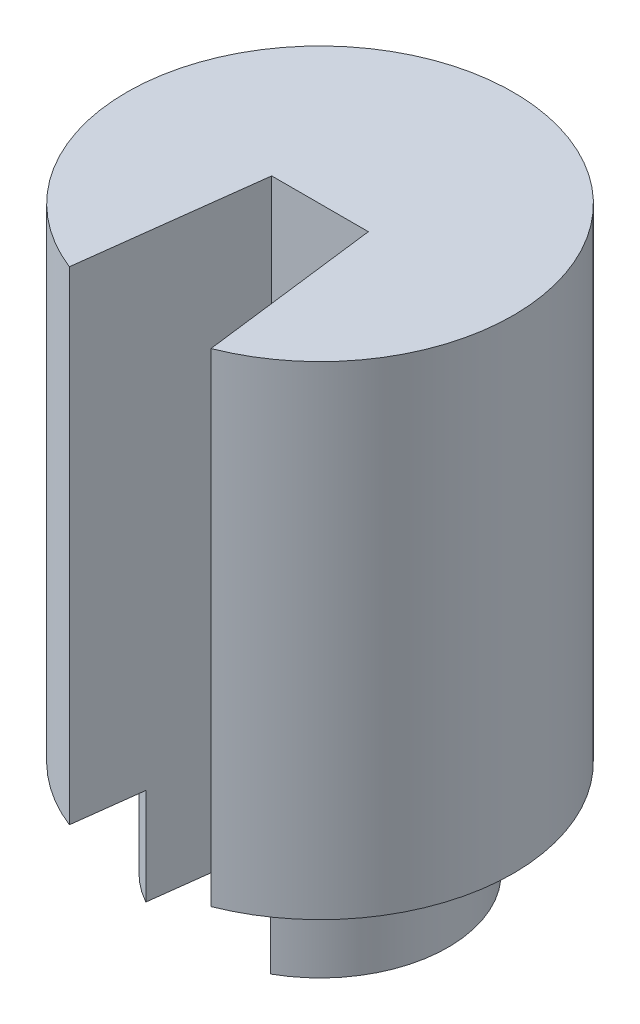
from build123d import *

# Parameters (mm, degrees)
SKETCH2_R           = 2.65
BOSS_EXTRUDE1_DEPTH = 2
SKETCH3_R           = 4
BOSS_EXTRUDE2_DEPTH = 10


with BuildPart() as part:
    # Sketch2 → Boss-Extrude1 (new body)
    with BuildSketch(Plane(origin=(0, 0, 0), x_dir=(1, 0, 0), z_dir=(0, 1, 0))):
        with Locations(Location((0, 0, 0), (0, 0, 270))):
            Circle(SKETCH2_R)
    extrude(amount=BOSS_EXTRUDE1_DEPTH)

    # Sketch3 → Boss-Extrude2 (add)
    with BuildSketch(Plane(origin=(0, 2, 0), x_dir=(1, 0, 0), z_dir=(0, 1, 0))):
        with Locations(Location((0, 0, 0), (0, 0, 270))):
            Circle(SKETCH3_R)
    extrude(amount=BOSS_EXTRUDE2_DEPTH)

    # Sketch4 → Cut-Loft1 section 0
    with BuildSketch(Plane.XY.offset(4)):
        with BuildLine():
            Line((-1.5, -12.39924767), (1.5, -12.39924767))
            Line((1.5, -12.39924767), (1.5, 12.39924767))
            Line((1.5, 12.39924767), (-1.5, 12.39924767))
            Line((-1.5, 12.39924767), (-1.5, -12.39924767))
        make_face()
    # Sketch5 → Cut-Loft1 section 1
    with BuildSketch(Plane.XY):
        with BuildLine():
            Line((-1, -12.21483131), (1, -12.21483131))
            Line((1, -12.21483131), (1, 12.21483131))
            Line((1, 12.21483131), (-1, 12.21483131))
            Line((-1, 12.21483131), (-1, -12.21483131))
        make_face()
    loft(mode=Mode.SUBTRACT)


solid = part.part
